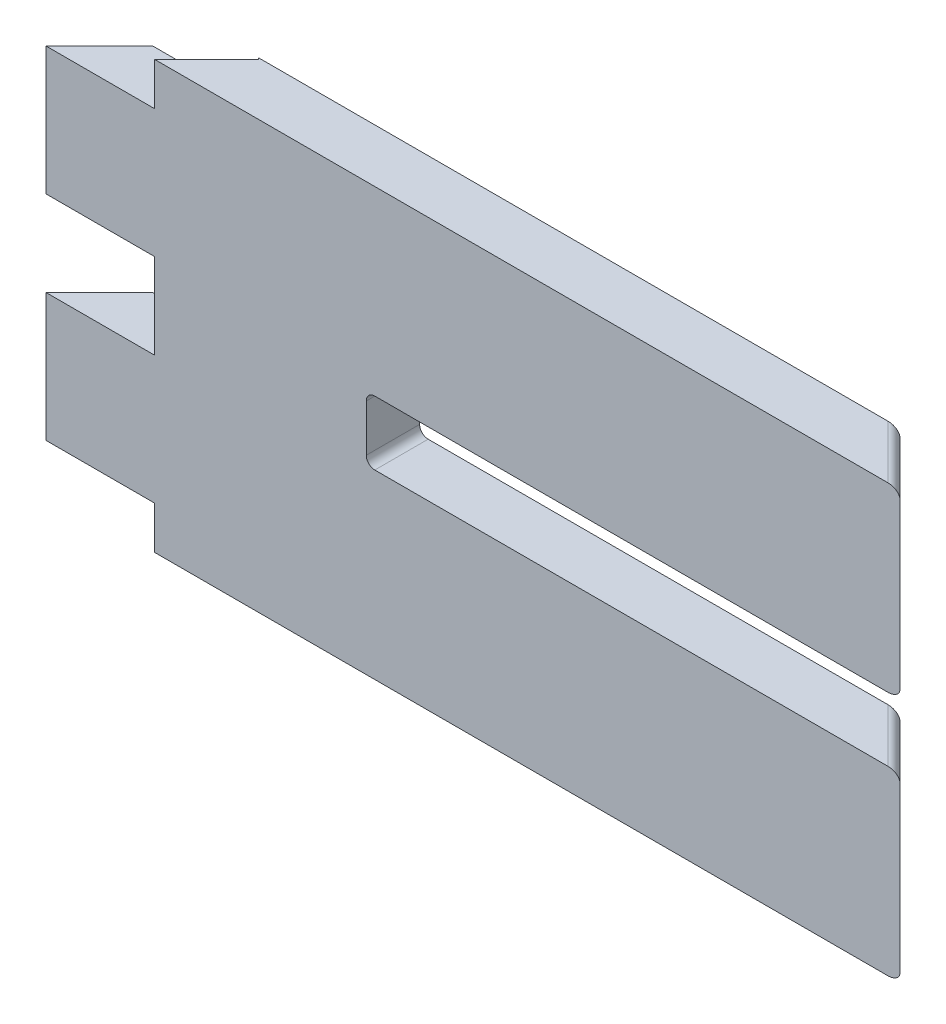
from build123d import *

# Parameters (mm, degrees)
BOSS_EXTRUDE1_DEPTH     = 2.5
CUT_EXTRUDE1_DEPTH      = 26.734218465
CUT_EXTRUDE2_DEPTH      = 26.734218465
BOSS_EXTRUDE2_DEPTH     = 2
BOSS_EXTRUDE3_DEPTH     = 2
CUT_EXTRUDE3_DEPTH      = 2
CUT_EXTRUDE3_DEPTH_BACK = 2
SKETCH9_W               = 3.535533906
SKETCH9_H               = 2
SKETCH9_H_2             = 4
CUT_EXTRUDE5_DEPTH      = 0.1
SKETCH10_W              = 20.9
SKETCH10_H              = 5.3
SKETCH10_H_2            = 5.296426242
SKETCH10_W_2            = 4.350252532
SKETCH10_H_3            = 16.8
CUT_EXTRUDE6_DEPTH      = 1.2
FILLET1_R               = 0.4


with BuildPart() as part:
    # Sketch1 → Boss-Extrude1 (new body)
    with BuildSketch(Plane.XY):
        Polygon((20, -1.5), (20, -8), (-20, -8), (-20, 8), (20, 8), (20, 1.5), (-5, 1.5), (-5, -1.5), align=None)
    extrude(amount=BOSS_EXTRUDE1_DEPTH)

    # Sketch2 → Cut-Extrude1 (cut, through all)
    with BuildSketch(Plane(origin=(0, 8, 0), x_dir=(1, 0, 0), z_dir=(0, 1, 0))):
        Polygon((20, -2.5), (17.5, 0), (20, 0), align=None)
    extrude(amount=-CUT_EXTRUDE1_DEPTH, mode=Mode.SUBTRACT)

    # Sketch5 → Cut-Extrude2 (cut, through all)
    with BuildSketch(Plane(origin=(0, 8, 0), x_dir=(1, 0, 0), z_dir=(0, 1, 0))):
        Polygon((-20, -2.5), (-17.5, 0), (-20, 0), align=None)
    extrude(amount=-CUT_EXTRUDE2_DEPTH, mode=Mode.SUBTRACT)

    # Sketch6 → Boss-Extrude2 (add)
    with BuildSketch(Plane(origin=(0, 8, 0), x_dir=(1, 0, 0), z_dir=(0, 1, 0))):
        Polygon((-12.550252532, 0), (-15.050252532, -2.5), (20, -2.5), (17.5, 0), align=None)
    extrude(amount=BOSS_EXTRUDE2_DEPTH)

    # Sketch7 → Boss-Extrude3 (add)
    with BuildSketch(Plane.XZ.offset(8)):
        Polygon((-12.550252532, 0), (17.5, 0), (20, 2.5), (-15.050252532, 2.5), align=None)
    extrude(amount=BOSS_EXTRUDE3_DEPTH)

    # Sketch8 → Cut-Extrude3 (cut, two sides: drawn at the far end of the back side and taken through both)
    with BuildSketch(Plane(origin=(0, 0, 0), x_dir=(1, 0, 0), z_dir=(0, 1, 0)).offset(-CUT_EXTRUDE3_DEPTH_BACK)):
        Polygon((-15.050252532, -2.5), (-12.550252532, 0), (-17.5, 0), (-20, -2.5), align=None)
    extrude(amount=CUT_EXTRUDE3_DEPTH + CUT_EXTRUDE3_DEPTH_BACK, mode=Mode.SUBTRACT)

    # Sketch9 → Cut-Extrude5 (cut)
    with BuildSketch(Plane(origin=(-6.275126266, 0, -6.275126266), x_dir=(-0.7071067811865476, 0, 0.7071067811865476), z_dir=(-0.7071067811865476, 0, -0.7071067811865476))):
        with Locations((10.642135624, 9)):
            Rectangle(SKETCH9_W, SKETCH9_H)
        with Locations((10.642135624, 0)):
            Rectangle(SKETCH9_W, SKETCH9_H_2)
        with Locations((10.642135624, -9)):
            Rectangle(SKETCH9_W, SKETCH9_H)
    extrude(amount=-CUT_EXTRUDE5_DEPTH, mode=Mode.SUBTRACT)

    # Sketch10 → Cut-Extrude6 (cut)
    with BuildSketch(Plane(origin=(0, 0, 0), x_dir=(-1, 0, 0), z_dir=(0, 0, -1))):
        with Locations((-5.45, -5.75)):
            Rectangle(SKETCH10_W, SKETCH10_H)
        with Locations((-5.45, 5.751786879)):
            Rectangle(SKETCH10_W, SKETCH10_H_2)
        with Locations((8.775126266, 0)):
            Rectangle(SKETCH10_W_2, SKETCH10_H_3)
    extrude(amount=-CUT_EXTRUDE6_DEPTH, mode=Mode.SUBTRACT)

    # Fillet1
    fillet1_edges = [part.edges().sort_by_distance(p)[0] for p in [
        (-5, 1.5, 1.25),
        (-5, -1.5, 1.25),
        (-10.950252532, 8.4, 0.6),
        (-10.950252532, -8.4, 0.6),
        (-6.6, -8.4, 0.6),
        (-6.6, 8.4, 0.6),
        (-5, 8.4, 0.6),
        (-5, 3.103573758, 0.6),
        (15.9, 3.103573758, 0.6),
        (15.9, 8.4, 0.6),
        (15.9, -8.4, 0.6),
        (15.9, -3.1, 0.6),
        (-5, -3.1, 0.6),
        (-5, -8.4, 0.6),
        (18.75, -1.5, 1.25),
        (18.75, 1.5, 1.25),
        (18.75, 10, 1.25),
        (18.75, -10, 1.25),
    ]]
    fillet(fillet1_edges, radius=FILLET1_R)


solid = part.part
